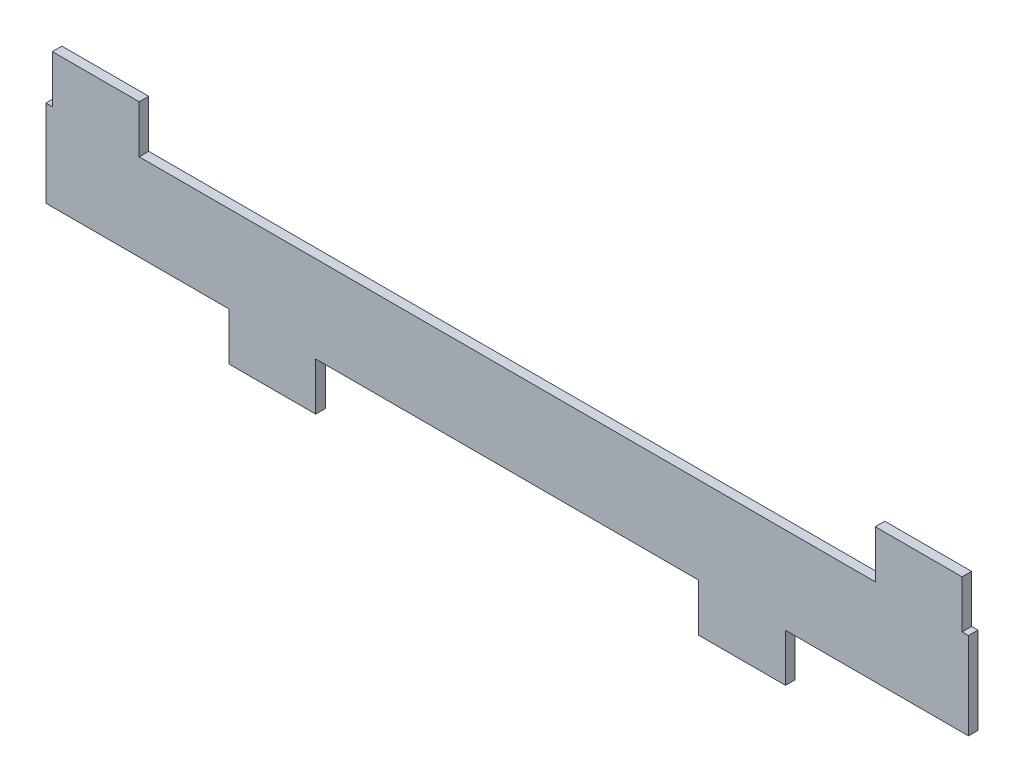
from build123d import *

# Parameters (mm, degrees)
BOSS_EXTRUDE1_DEPTH = 3


with BuildPart() as part:
    # Model → Boss-Extrude1 (new body)
    with BuildSketch(Plane.XY):
        Polygon((325.321685699, 71.800119174), (325.321685699, 99.100119174), (323.321685699, 99.100119174), (323.321685699, 114.100119174), (296.021685699, 114.100119174), (296.021685699, 99.100119174), (64.621685699, 99.100119174), (64.621685699, 114.100119174), (37.321685699, 114.100119174), (37.321685699, 99.100119174), (35.321685699, 99.100119174), (35.321685699, 71.800119174), (92.821685699, 71.800119174), (92.821685699, 56.800119174), (120.121685699, 56.800119174), (120.121685699, 71.800119174), (240.521685699, 71.800119174), (240.521685699, 56.800119174), (267.821685699, 56.800119174), (267.821685699, 71.800119174), align=None)
    extrude(amount=BOSS_EXTRUDE1_DEPTH)


solid = part.part
